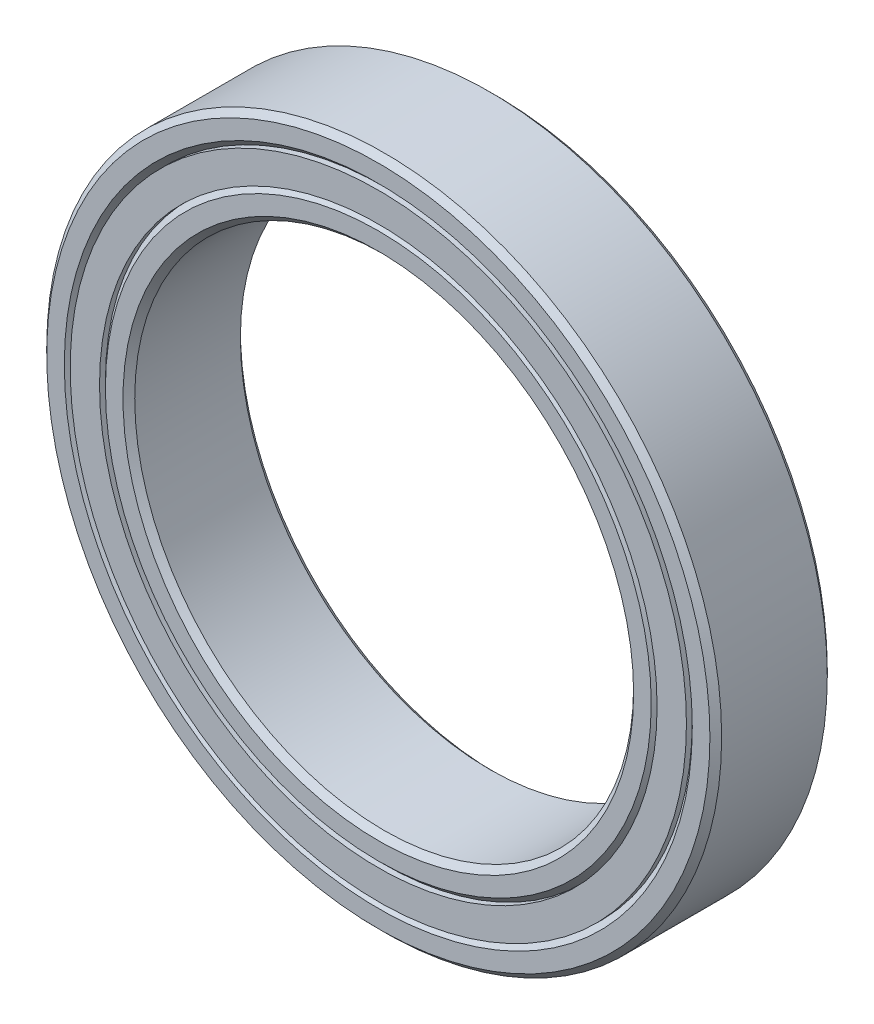
from build123d import *

# Parameters (mm, degrees)
SKETCH1_R             = 11.5
SKETCH1_R_2           = 10.5
BOSS_EXTRUDE1_DEPTH   = 4
SKETCH1_R_3           = 9.5
SKETCH1_R_4           = 8.5
BOSS_EXTRUDE1_2_DEPTH = 4
CHAMFER1_SIZE         = 0.2
CHAMFER2_SIZE         = 0.2
SKETCH1_3_R           = 10.5
SKETCH1_3_R_2         = 9.5
BOSS_EXTRUDE2_DEPTH   = 4


with BuildPart() as part:
    # Sketch1 → Boss-Extrude1 (new body)
    with BuildSketch(Plane.XY):
        Circle(SKETCH1_R)
        Circle(SKETCH1_R_2, mode=Mode.SUBTRACT)
    extrude(amount=BOSS_EXTRUDE1_DEPTH)

    # Chamfer1
    chamfer1_edges = [part.edges().sort_by_distance(p)[0] for p in [
        (-11.5, 0, 0),
        (-10.5, 0, 0),
        (-10.5, 0, 4),
        (-11.5, 0, 4),
    ]]
    chamfer(chamfer1_edges, length=CHAMFER1_SIZE)



with BuildPart() as body_2:
    # Sketch1 → Boss-Extrude1 2 (new body)
    with BuildSketch(Plane.XY):
        Circle(SKETCH1_R_3)
        Circle(SKETCH1_R_4, mode=Mode.SUBTRACT)
    extrude(amount=BOSS_EXTRUDE1_2_DEPTH)

    # Chamfer2
    chamfer2_edges = [body_2.edges().sort_by_distance(p)[0] for p in [
        (-8.5, 0, 0),
        (-9.5, 0, 0),
        (-8.5, 0, 4),
        (-9.5, 0, 4),
    ]]
    chamfer(chamfer2_edges, length=CHAMFER2_SIZE)


with BuildPart() as part_1:
    add(part.part)

    add(body_2.part)  # Boss-Extrude2 merges body 2
    # Sketch1<3> → Boss-Extrude2 (add)
    with BuildSketch(Plane.XY):
        Circle(SKETCH1_3_R)
        Circle(SKETCH1_3_R_2, mode=Mode.SUBTRACT)
    extrude(amount=BOSS_EXTRUDE2_DEPTH)


solid = part_1.part
